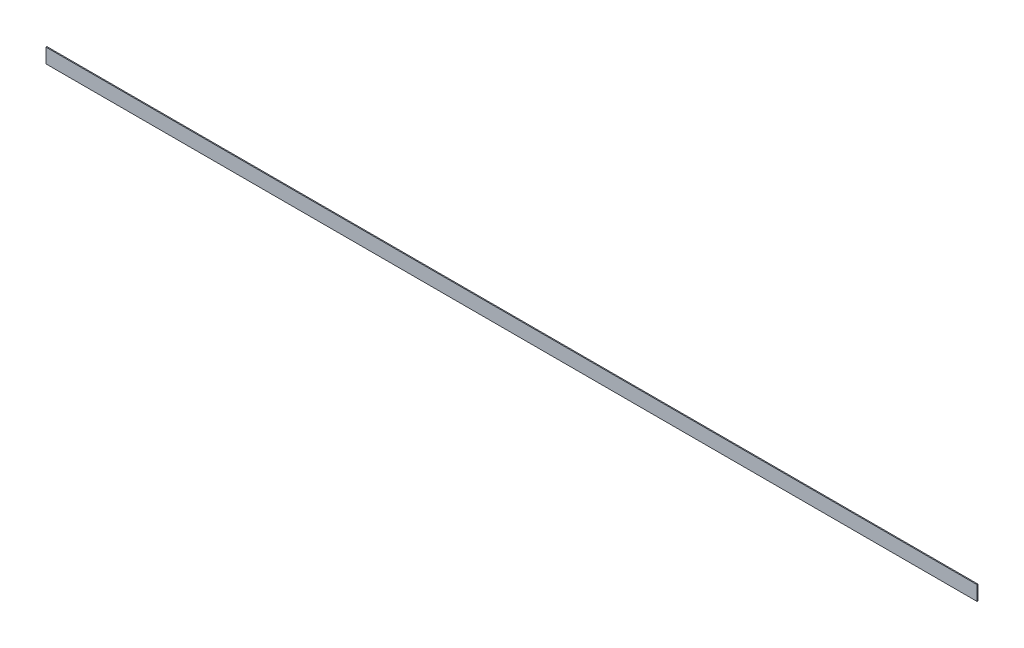
from build123d import *

# Parameters (mm, degrees)
SKETCH1_W           = 1219.2
SKETCH1_H           = 19.05
BOSS_EXTRUDE1_DEPTH = 1.27


with BuildPart() as part:
    # Sketch1 → Boss-Extrude1 (new body)
    with BuildSketch(Plane.XY):
        with Locations((609.6, 9.525)):
            Rectangle(SKETCH1_W, SKETCH1_H)
    extrude(amount=BOSS_EXTRUDE1_DEPTH)


solid = part.part
